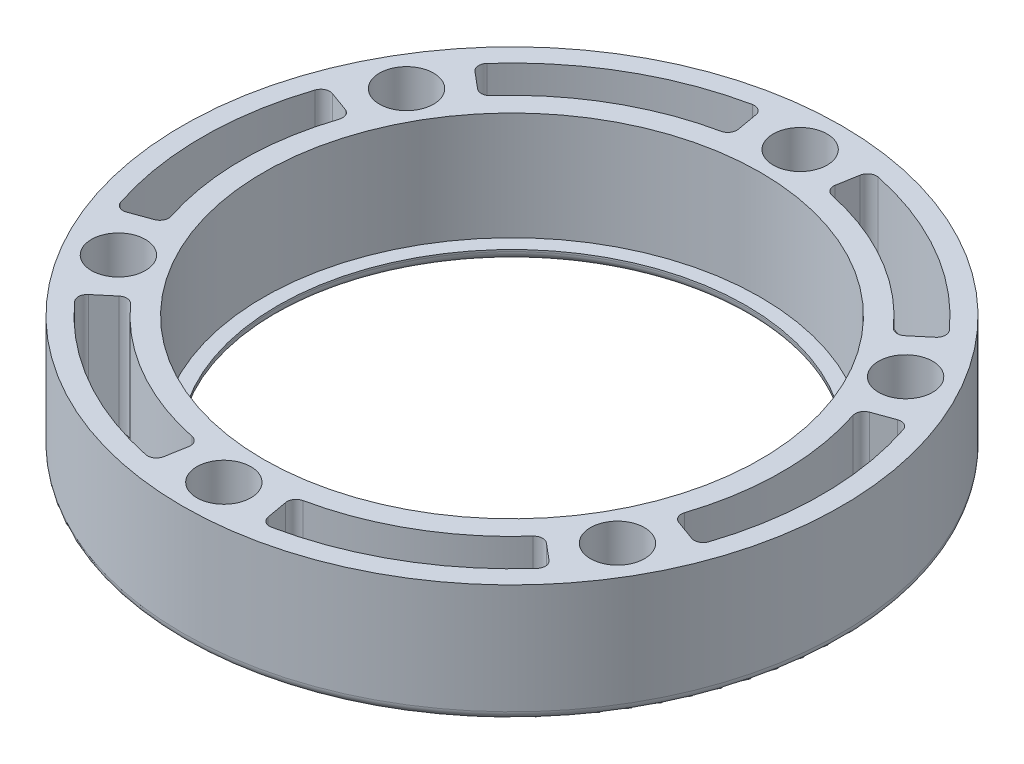
from build123d import *

# Parameters (mm, degrees)
SKETCH_2_R               = 7.5
CUT_EXTRUDE_1_DEPTH      = 134.542128184
CUT_EXTRUDE_2_DEPTH      = 134.542128184
PATTERN_CIRCULAR_1_COUNT = 6
FILLET_1_R               = 2.5


with BuildPart() as part:
    # 草图1 → 旋转1 (revolve)
    with BuildSketch(Plane(origin=(0, 0, 0), x_dir=(0, 0, -1), z_dir=(1, 0, 0)), mode=Mode.PRIVATE) as revolve_1_sk:
        Polygon((-91.5, 33), (-91.5, 0), (-65, 0), (-65, 3), (-69, 3), (-69, 33), align=None)
    revolve(revolve_1_sk.sketch.rotate(Axis((0, 0, 0), (0, 1, 0)), 180), axis=Axis((0, 0, 0), (0, 1, 0)))

    # 草图2 → 切除-拉伸1 (cut, through all)
    with BuildSketch(Plane(origin=(0, 33, 0), x_dir=(1, 0, 0), z_dir=(0, 1, 0))):
        with Locations(Location((0, 80, 0), (0, 0, 270))):
            Circle(SKETCH_2_R)
    cut_extrude_1 = extrude(amount=-CUT_EXTRUDE_1_DEPTH, mode=Mode.SUBTRACT)

    # 草图3 → 切除-拉伸2 (cut, through all)
    with BuildSketch(Plane(origin=(0, 33, 0), x_dir=(1, 0, 0), z_dir=(0, 1, 0))):
        with BuildLine():
            Line((-72.788277417, 26.492766383), (-78.429157814, 28.545878943))
            ThreePointArc((-78.429157814, 28.545878943), (-80.374557913, 28.44634458), (-81.65798686, 26.980978151))
            ThreePointArc((-81.65798686, 26.980978151), (-86, 0), (-81.65798686, -26.980978151))
            ThreePointArc((-81.65798686, -26.980978151), (-80.374557913, -28.44634458), (-78.429157814, -28.545878943))
            Line((-78.429157814, -28.545878943), (-72.788277417, -26.492766383))
            ThreePointArc((-72.788277417, -26.492766383), (-71.394896395, -25.236492438), (-71.267736557, -23.364711127))
            ThreePointArc((-71.267736557, -23.364711127), (-75, 0), (-71.267736557, 23.364711127))
            ThreePointArc((-71.267736557, 23.364711127), (-71.394896395, 25.236492438), (-72.788277417, 26.492766383))
        make_face()
    cut_extrude_2 = extrude(amount=-CUT_EXTRUDE_2_DEPTH, mode=Mode.SUBTRACT)

    # 阵列(圆周)1: 切除-拉伸1, 切除-拉伸2 ×6 about axis
    pattern_circular_1_axis = Axis((0, 0, 0), (0, 1, 0))
    add([cut_extrude_1.rotate(pattern_circular_1_axis, i * 360 / PATTERN_CIRCULAR_1_COUNT) for i in range(1, PATTERN_CIRCULAR_1_COUNT)], mode=Mode.SUBTRACT)
    add([cut_extrude_2.rotate(pattern_circular_1_axis, i * 360 / PATTERN_CIRCULAR_1_COUNT) for i in range(1, PATTERN_CIRCULAR_1_COUNT)], mode=Mode.SUBTRACT)

    # 圆角1
    fillet_1_edges = [part.edges().sort_by_distance(p)[0] for p in [
        (0, 0, 65),
        (0, 0, 91.5),
    ]]
    fillet(fillet_1_edges, radius=FILLET_1_R)


solid = part.part
